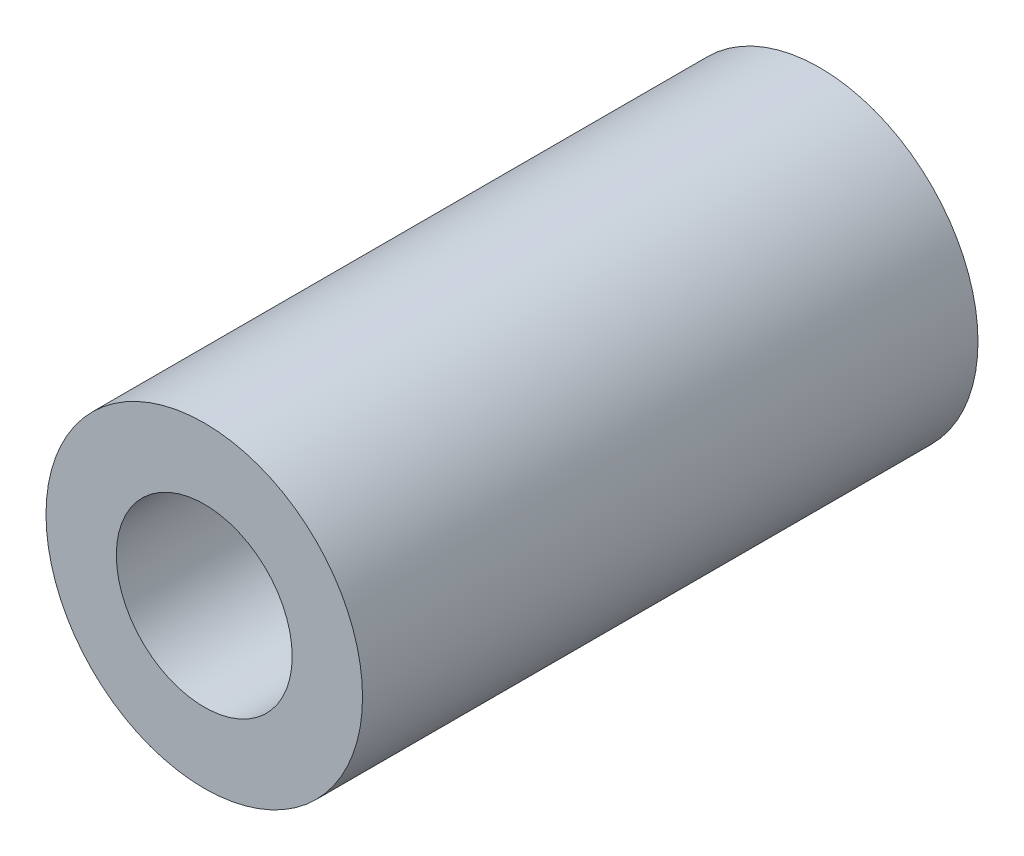
from build123d import *

# Parameters (mm, degrees)
ESQUISSE1_R        = 9
ESQUISSE1_R_2      = 5
BOSS_EXTRU_1_DEPTH = 35


with BuildPart() as part:
    # Esquisse1 → Boss.-Extru.1 (new body)
    with BuildSketch(Plane.XY):
        Circle(ESQUISSE1_R)
        Circle(ESQUISSE1_R_2, mode=Mode.SUBTRACT)
    extrude(amount=BOSS_EXTRU_1_DEPTH)


solid = part.part
